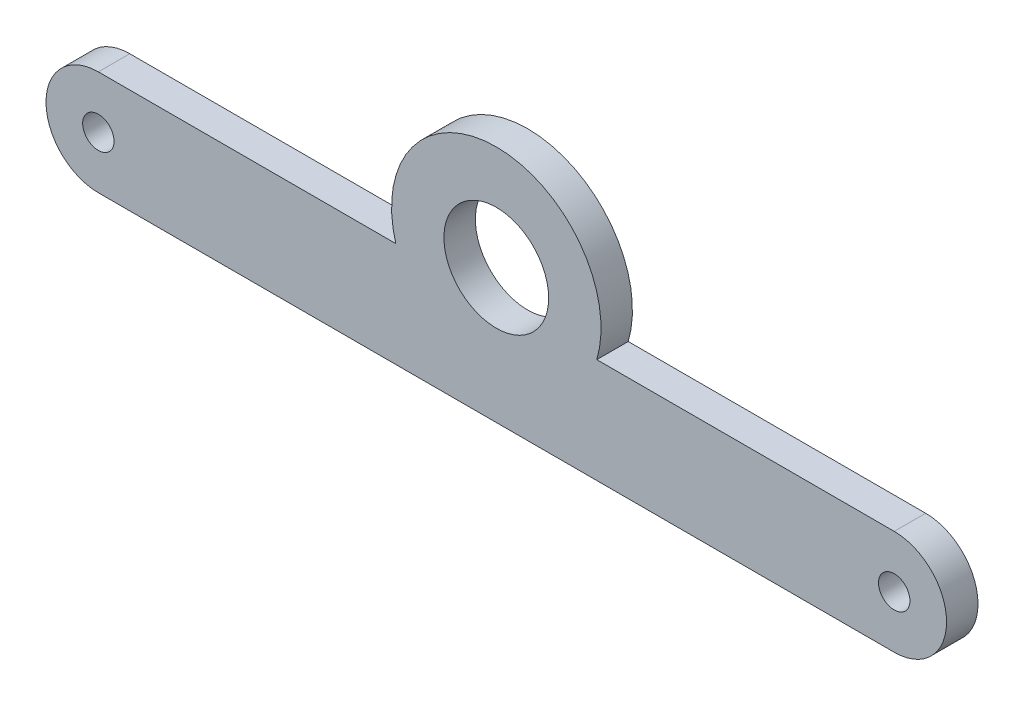
from build123d import *

# Parameters (mm, degrees)
SKETCH1_R           = 5
SKETCH1_R_2         = 1.5
BOSS_EXTRUDE1_DEPTH = 3


with BuildPart() as part:
    # Sketch1 → Boss-Extrude1 (new body)
    with BuildSketch(Plane.XY):
        with BuildLine():
            Line((-63.727937359, 5), (-35.327937359, 5))
            ThreePointArc((-35.327937359, 5), (-25.727937359, 17.8), (-16.127937359, 5))
            Line((-16.127937359, 5), (12.272062641, 5))
            ThreePointArc((12.272062641, 5), (17.272062641, 0), (12.272062641, -5))
            Line((12.272062641, -5), (-63.727937359, -5))
            ThreePointArc((-63.727937359, -5), (-68.727937359, 0), (-63.727937359, 5))
        make_face()
        with Locations((-25.727937359, 7.8)):
            Circle(SKETCH1_R, mode=Mode.SUBTRACT)
        with Locations((-63.727937359, 0)):
            Circle(SKETCH1_R_2, mode=Mode.SUBTRACT)
        with Locations((12.272062641, 0)):
            Circle(SKETCH1_R_2, mode=Mode.SUBTRACT)
    extrude(amount=BOSS_EXTRUDE1_DEPTH)


solid = part.part
